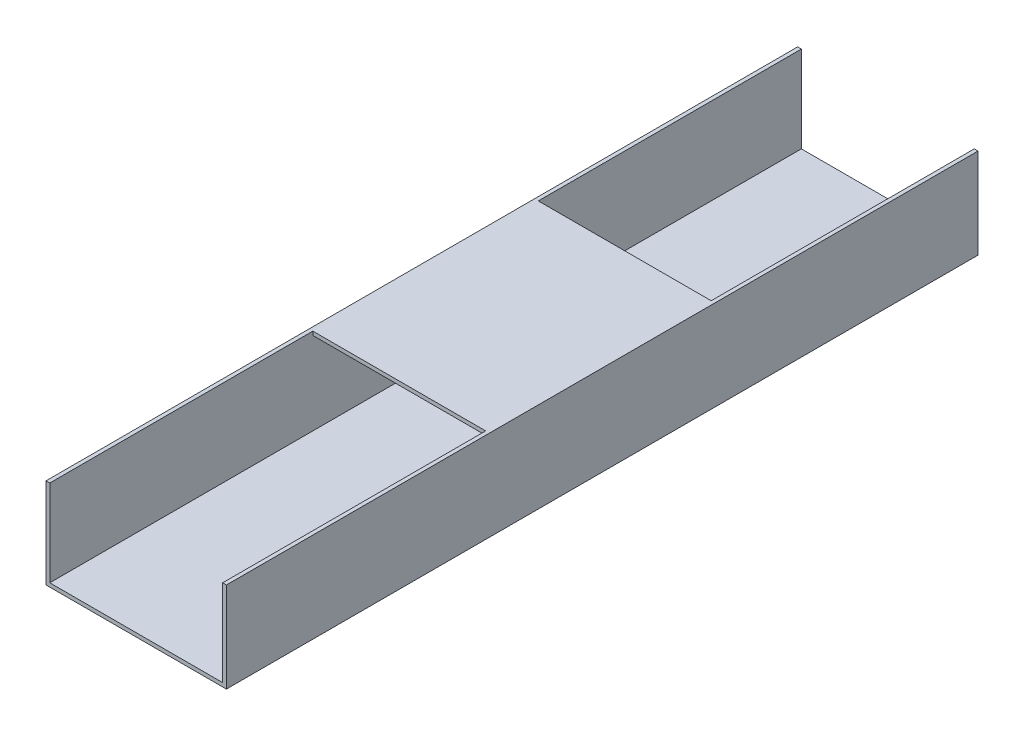
from build123d import *

# Parameters (mm, degrees)
SKETCH1_W           = 48
SKETCH1_H           = 24
SKETCH1_W_2         = 46
SKETCH1_H_2         = 22
BOSS_EXTRUDE1_DEPTH = 200
SKETCH2_W           = 46
SKETCH2_H           = 70
CUT_EXTRUDE1_DEPTH  = 23


with BuildPart() as part:
    # Sketch1 → Boss-Extrude1 (new body)
    with BuildSketch(Plane.XY):
        Rectangle(SKETCH1_W, SKETCH1_H)
        Rectangle(SKETCH1_W_2, SKETCH1_H_2, mode=Mode.SUBTRACT)
    extrude(amount=BOSS_EXTRUDE1_DEPTH)

    # Sketch2 → Cut-Extrude1 (cut)
    with BuildSketch(Plane(origin=(0, 12, 0), x_dir=(1, 0, 0), z_dir=(0, 1, 0))):
        with Locations((0, -165)):
            Rectangle(SKETCH2_W, SKETCH2_H)
        with Locations((0, -35)):
            Rectangle(SKETCH2_W, SKETCH2_H)
    extrude(amount=-CUT_EXTRUDE1_DEPTH, mode=Mode.SUBTRACT)


solid = part.part
